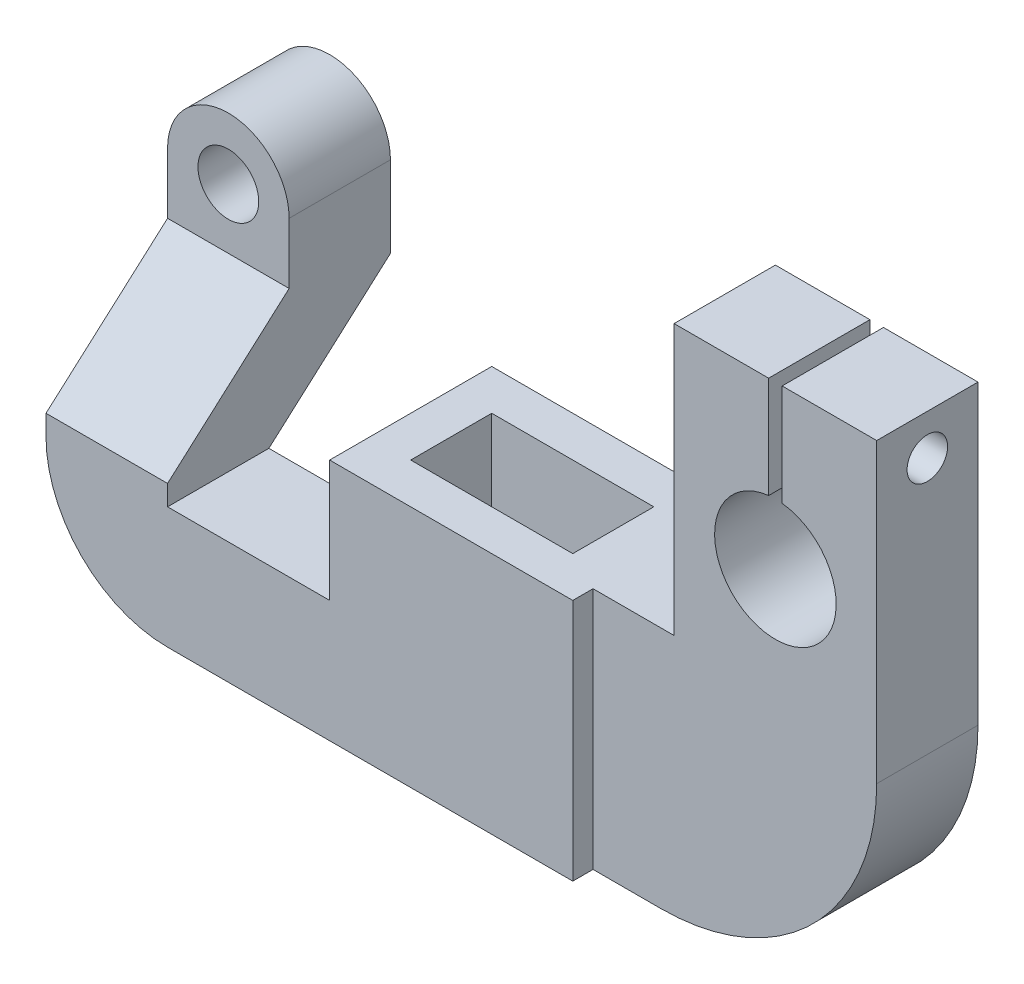
from build123d import *

# Parameters (mm, degrees)
BOSS_EXTRUDE1_DEPTH     = 15
SKETCH2_W               = 24
SKETCH2_H               = 12
BOSS_EXTRUDE2_DEPTH     = 36
SKETCH3_W               = 42
SKETCH3_H               = 18
BOSS_EXTRUDE3_DEPTH     = 15
SKETCH4_R               = 3
CUT_EXTRUDE1_DEPTH      = 34
BOSS_EXTRUDE5_DEPTH     = 18
SKETCH7_R               = 9
BOSS_EXTRUDE8_DEPTH     = 15
CUT_EXTRUDE2_DEPTH      = 90.487429285
CUT_EXTRUDE2_DEPTH_BACK = 90.487429285
SKETCH8_R               = 4.5
FILLET1_R               = 18
FILLET2_R               = 32


with BuildPart() as part:
    # Sketch1 → Boss-Extrude1 (new body)
    with BuildSketch(Plane.XY):
        with BuildLine():
            Line((0, 0), (12, 0))
            Line((12, 0), (12, 40))
            Line((12, 40), (26, 40))
            Line((26, 40), (26, 24.94427191))
            ThreePointArc((26, 24.94427191), (27, 7), (28, 24.94427191))
            Line((28, 24.94427191), (28, 40))
            Line((28, 40), (42, 40))
            Line((42, 40), (42, -36))
            Line((42, -36), (0, -36))
            Line((0, -36), (0, 0))
        make_face()
    extrude(amount=BOSS_EXTRUDE1_DEPTH)

    # Sketch2 → Boss-Extrude2 (add)
    with BuildSketch(Plane(origin=(0, 0, 0), x_dir=(1, 0, 0), z_dir=(0, 1, 0))):
        Polygon((-36, -18), (0, -18), (0, -15), (0, 0), (0, 6), (-36, 6), align=None)
        with Locations((-18, -6)):
            Rectangle(SKETCH2_W, SKETCH2_H, mode=Mode.SUBTRACT)
    extrude(amount=-BOSS_EXTRUDE2_DEPTH)

    # Sketch3 → Boss-Extrude3 (add)
    with BuildSketch(Plane.XY.offset(18)):
        with Locations((-57, -27)):
            Rectangle(SKETCH3_W, SKETCH3_H)
    extrude(amount=-BOSS_EXTRUDE3_DEPTH)

    # Sketch4 → Cut-Extrude1 (cut)
    with BuildSketch(Plane(origin=(42, 0, 0), x_dir=(0, 0, -1), z_dir=(1, 0, 0))):
        with Locations((-7.5, 34)):
            Circle(SKETCH4_R)
    extrude(amount=-CUT_EXTRUDE1_DEPTH, mode=Mode.SUBTRACT)

    # Sketch6 → Boss-Extrude5 (add)
    with BuildSketch(Plane.ZY.offset(78)):
        Polygon((3, -18), (-15, -2), (-15, 10), (0, 10), (0, 1), (18, -15), (18, -18), align=None)
    extrude(amount=-BOSS_EXTRUDE5_DEPTH)

    # Sketch7 → Boss-Extrude8 (add)
    with BuildSketch(Plane.XY):
        with Locations((-69, 10)):
            Circle(SKETCH7_R)
    extrude(amount=-BOSS_EXTRUDE8_DEPTH)

    # Sketch8 → Cut-Extrude2 (cut, two sides: drawn at the far end of the back side and taken through both)
    with BuildSketch(Plane.XY.offset(-CUT_EXTRUDE2_DEPTH_BACK)):
        with Locations((-69.000940425, 9.869897064)):
            Circle(SKETCH8_R)
    extrude(amount=CUT_EXTRUDE2_DEPTH + CUT_EXTRUDE2_DEPTH_BACK, mode=Mode.SUBTRACT)

    # Fillet1
    fillet1_edges = [part.edges().sort_by_distance(p)[0] for p in [
        (-78, -36, 10.5),
    ]]
    fillet(fillet1_edges, radius=FILLET1_R)

    # Fillet2
    fillet2_edges = [part.edges().sort_by_distance(p)[0] for p in [
        (42, -36, 7.5),
    ]]
    fillet(fillet2_edges, radius=FILLET2_R)


solid = part.part
